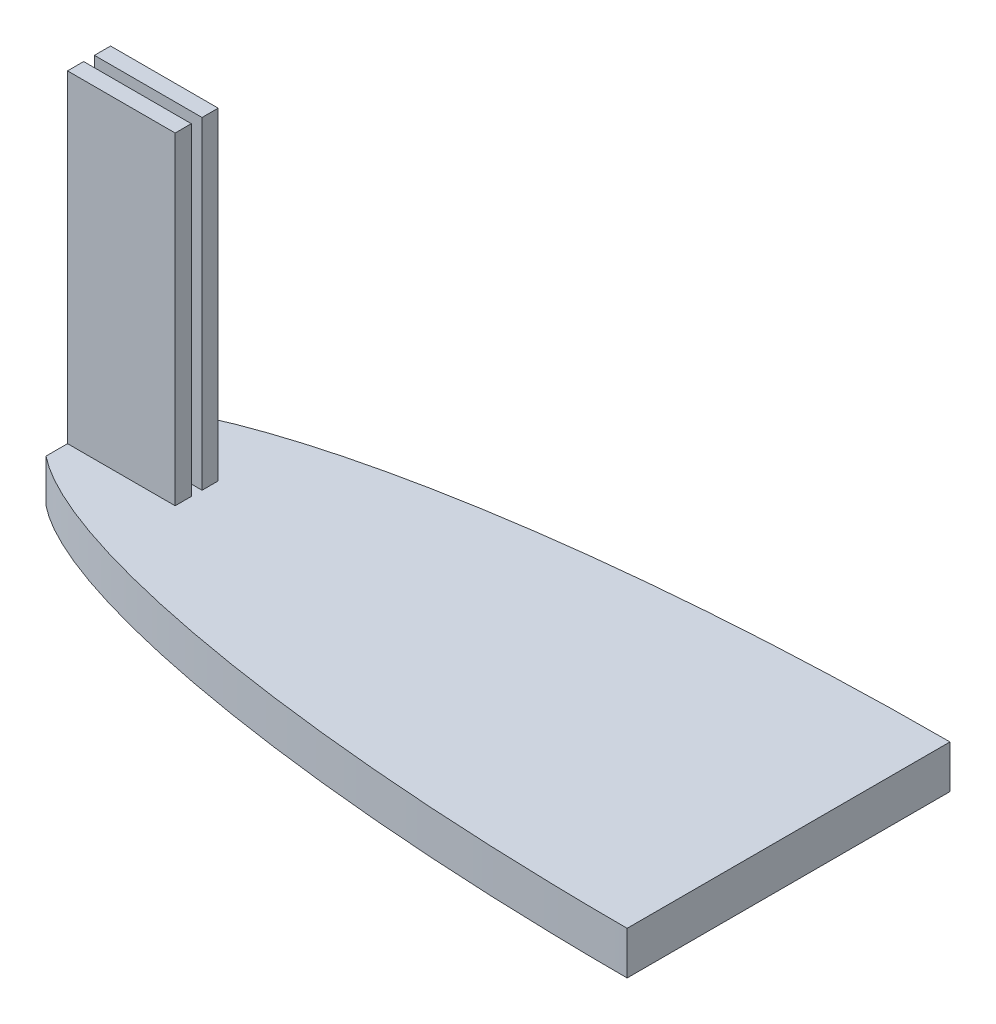
from build123d import *

# Parameters (mm, degrees)
BOSS_EXTRUDE1_DEPTH = 4
SKETCH2_W           = 10
SKETCH2_H           = 1.5
BOSS_EXTRUDE3_DEPTH = 30


with BuildPart() as part:
    # Sketch1 → Boss-Extrude1 (new body)
    with BuildSketch(Plane(origin=(0, 0, 0), x_dir=(1, 0, 0), z_dir=(0, 1, 0))):
        with BuildLine():
            Line((32.5, -15), (32.5, 15))
            add(Edge.make_bspline(
                [(32.5, 15), (-18.815789474, 15), (-32.5, 4)],
                knots=[1.570796327, 1.570796327, 1.570796327, 2.871659858, 2.871659858, 2.871659858], degree=2, weights=[1, 0.795822426, 1]))
            Line((-32.5, 4), (-32.5, -4))
            add(Edge.make_bspline(
                [(-32.5, -4), (-18.815789474, -15), (32.5, -15)],
                knots=[3.411525449, 3.411525449, 3.411525449, 4.71238898, 4.71238898, 4.71238898], degree=2, weights=[1, 0.795822426, 1]))
        make_face()
    extrude(amount=BOSS_EXTRUDE1_DEPTH)

    # Sketch2 → Boss-Extrude3 (add)
    with BuildSketch(Plane(origin=(0, 4, 0), x_dir=(1, 0, 0), z_dir=(0, 1, 0))):
        with Locations((-27.5, -1.25)):
            Rectangle(SKETCH2_W, SKETCH2_H)
        with Locations((-27.5, 1.25)):
            Rectangle(SKETCH2_W, SKETCH2_H)
    extrude(amount=BOSS_EXTRUDE3_DEPTH)


solid = part.part
